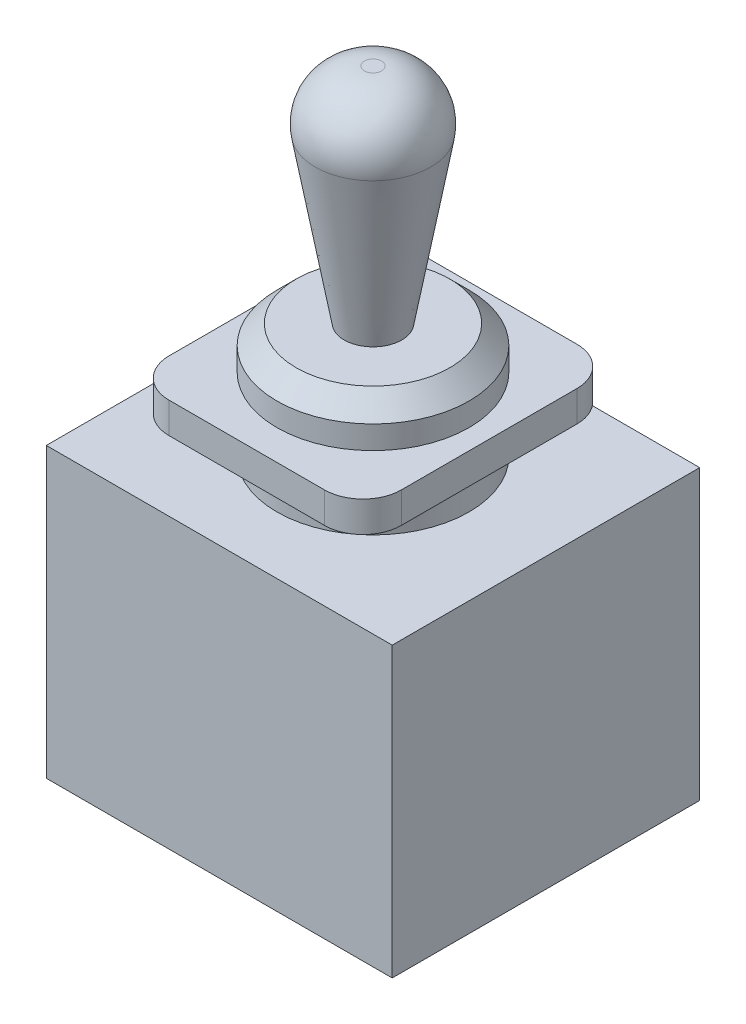
from build123d import *

# Parameters (mm, degrees)
SKETCH_1_W      = 9
SKETCH_1_H      = 8
EXTRUDE_1_DEPTH = 3.75
SKETCH_2_R      = 2.5
EXTRUDE_2_DEPTH = 3
CHAMFER_1_SIZE  = 0.5
EXTRUDE_3_DEPTH = 0.8
SKETCH_4_R      = 0.75
EXTRUDE_4_DEPTH = 5.8
EXTRUDE_4_DRAFT = -10
FILLET_1_R      = 1.3


with BuildPart() as part:
    # Эскиз1 → Бобышка-Вытянуть1 (new, symmetric)
    with BuildSketch(Plane(origin=(0, 0, 0), x_dir=(1, 0, 0), z_dir=(0, 1, 0))):
        Rectangle(SKETCH_1_W, SKETCH_1_H)
    extrude(amount=EXTRUDE_1_DEPTH, both=True)

    # Эскиз2 → Бобышка-Вытянуть2 (add)
    with BuildSketch(Plane(origin=(0, 3.75, 0), x_dir=(1, 0, 0), z_dir=(0, 1, 0))):
        with Locations(Location((0, 0, 0), (0, 0, 270))):
            Circle(SKETCH_2_R)
    extrude(amount=EXTRUDE_2_DEPTH)

    # Фаска1
    chamfer_1_edges = [part.edges().sort_by_distance(p)[0] for p in [
        (0, 6.75, -2.5),
    ]]
    chamfer(chamfer_1_edges, length=CHAMFER_1_SIZE)

    # Эскиз3 → Бобышка-Вытянуть3 (add)
    with BuildSketch(Plane(origin=(0, 5.65, 0), x_dir=(1, 0, 0), z_dir=(0, 1, 0))):
        with BuildLine():
            Line((-2.020987717, -3.283260181), (2.020987717, -3.283260181))
            ThreePointArc((2.020987717, -3.283260181), (2.728094498, -2.990366962), (3.020987717, -2.283260181))
            Line((3.020987717, -2.283260181), (3.020987717, 2.283260181))
            ThreePointArc((3.020987717, 2.283260181), (2.728094498, 2.990366962), (2.020987717, 3.283260181))
            Line((2.020987717, 3.283260181), (-2.020987717, 3.283260181))
            ThreePointArc((-2.020987717, 3.283260181), (-2.728094498, 2.990366962), (-3.020987717, 2.283260181))
            Line((-3.020987717, 2.283260181), (-3.020987717, -2.283260181))
            ThreePointArc((-3.020987717, -2.283260181), (-2.728094498, -2.990366962), (-2.020987717, -3.283260181))
        make_face()
    extrude(amount=-EXTRUDE_3_DEPTH)


with BuildPart() as extrude_4_tool:
    # Эскиз4 → Бобышка-Вытянуть4 (with draft: the straight prism first)
    with BuildSketch(Plane(origin=(0, 6.75, 0), x_dir=(1, 0, 0), z_dir=(0, 1, 0))):
        Circle(SKETCH_4_R)
    extrude(amount=EXTRUDE_4_DEPTH)
    # Бобышка-Вытянуть4: the draft: its side faces are tilted about the plane it starts from
    extrude_4_sides = [extrude_4_tool.faces().sort_by_distance(p)[0] for p in [
        (-0.75, 9.65, 0),
    ]]
    draft(extrude_4_sides, Plane(origin=(0, 6.75, 0), x_dir=(1, 0, 0), z_dir=(0, 1, 0)), EXTRUDE_4_DRAFT)


with BuildPart() as part_1:
    add(part.part)

    # Бобышка-Вытянуть4: add extrude_4_tool
    add(extrude_4_tool.part)

    # Скругление1
    fillet_1_edges = [part_1.edges().sort_by_distance(p)[0] for p in [
        (-1.772696488, 12.55, 0),
    ]]
    fillet(fillet_1_edges, radius=FILLET_1_R)


solid = part_1.part
